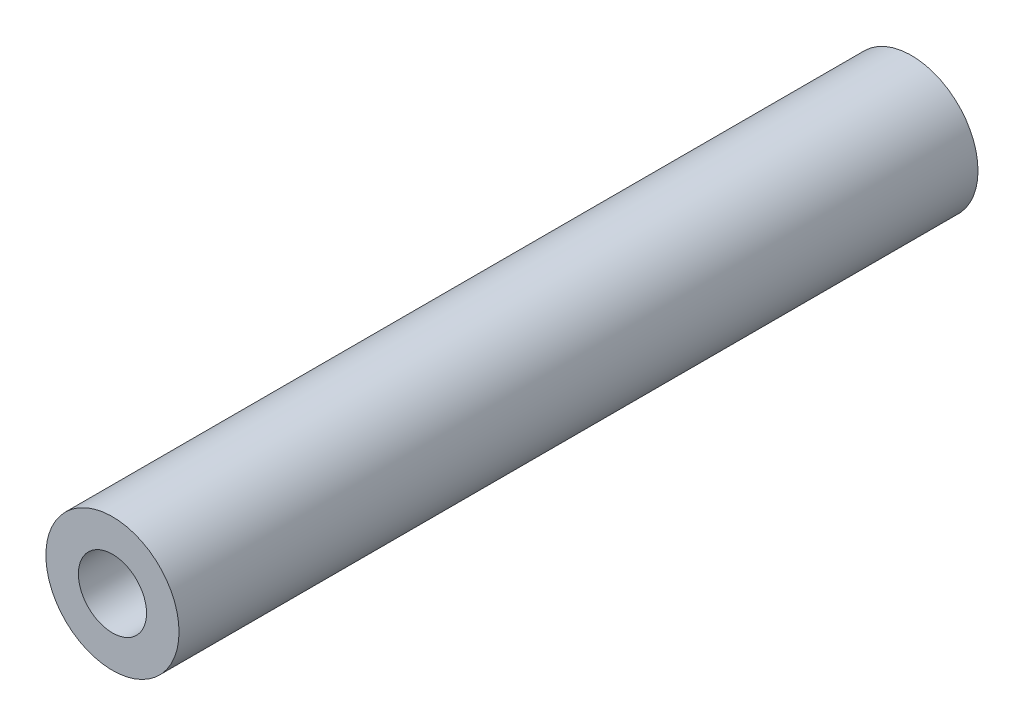
from build123d import *

# Parameters (mm, degrees)
SKETCH1_R      = 4.7625
SKETCH1_R_2    = 2.4384
EXTRUDE1_DEPTH = 28.575


with BuildPart() as part:
    # Sketch1 → Extrude1 (new, symmetric)
    with BuildSketch(Plane.XY):
        Circle(SKETCH1_R)
        Circle(SKETCH1_R_2, mode=Mode.SUBTRACT)
    extrude(amount=EXTRUDE1_DEPTH, both=True)


solid = part.part
